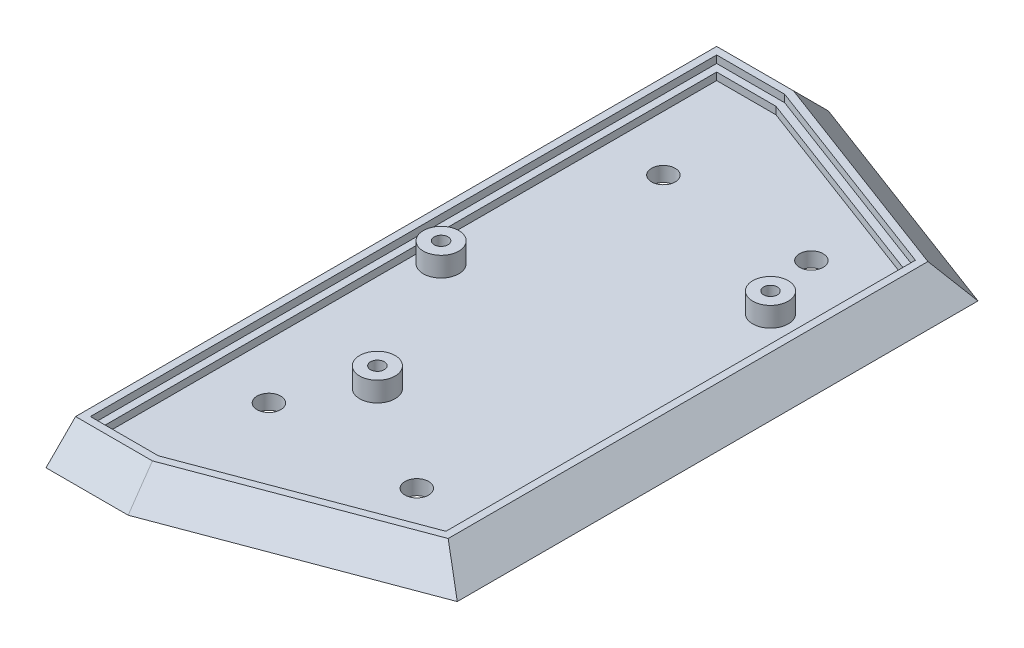
from build123d import *

# Parameters (mm, degrees)
CUT_EXTRUDE4_DEPTH  = 1.905
SKETCH15_R          = 2.286
BOSS_EXTRUDE3_DEPTH = 2.54
SKETCH17_R          = 0.889
CUT_EXTRUDE5_DEPTH  = 3.81
CUT_EXTRUDE6_DEPTH  = 0.9525
CUT_EXTRUDE9_DEPTH  = 205.915011065


with BuildPart() as part:
    # Sketch2 → Loft3 section 0
    with BuildSketch(Plane(origin=(0, 0, 0), x_dir=(1, 0, 0), z_dir=(0, 1, 0))):
        with BuildLine():
            Line((153.170003889, 0), (183.992068321, 11.558274162))
            Line((183.992068321, 11.558274162), (183.992068321, 78.611725838))
            Line((183.992068321, 78.611725838), (153.170003889, 90.17))
            Line((153.170003889, 90.17), (142.590068321, 90.17))
            Line((142.590068321, 90.17), (142.590068321, 0))
            Line((142.590068321, 0), (153.170003889, 0))
        make_face()
    # Sketch3 → Loft3 section 1
    with BuildSketch(Plane(origin=(0, 3.81, 0), x_dir=(1, 0, 0), z_dir=(0, 1, 0))):
        with BuildLine():
            Line((142.590068321, 3.81), (142.590068321, 86.36))
            Line((142.590068321, 86.36), (152.479119132, 86.36))
            Line((152.479119132, 86.36), (180.182068321, 75.971394054))
            Line((180.182068321, 75.971394054), (180.182068321, 14.198605946))
            Line((180.182068321, 14.198605946), (152.479119132, 3.81))
            Line((152.479119132, 3.81), (142.590068321, 3.81))
        make_face()
    loft()

    # Sketch14 → Cut-Extrude4 (cut)
    with BuildSketch(Plane(origin=(0, 3.81, 0), x_dir=(1, 0, 0), z_dir=(0, 1, 0))):
        Polygon((178.277068321, 74.651228162), (152.133676754, 84.455), (144.495068321, 84.455), (144.495068321, 5.715), (152.133676754, 5.715), (178.277068321, 15.518771838), align=None)
    extrude(amount=-CUT_EXTRUDE4_DEPTH, mode=Mode.SUBTRACT)

    # Sketch15 → Boss-Extrude3 (add)
    with BuildSketch(Plane(origin=(0, 1.905, 0), x_dir=(1, 0, 0), z_dir=(0, 1, 0))):
        with Locations(Location((173.959068321, 61.9252, 0), (0, 0, 270))):
            Circle(SKETCH15_R)
        with Locations(Location((147.162068321, 46.3042, 0), (0, 0, 270))):
            Circle(SKETCH15_R)
        with Locations(Location((156.991868321, 28.2702, 0), (0, 0, 270))):
            Circle(SKETCH15_R)
    extrude(amount=BOSS_EXTRUDE3_DEPTH)

    # Sketch17 → Cut-Extrude5 (cut)
    with BuildSketch(Plane(origin=(0, 4.445, 0), x_dir=(1, 0, 0), z_dir=(0, 1, 0))):
        with Locations(Location((156.991868321, 28.2702, 0), (0, 0, 270))):
            Circle(SKETCH17_R)
        with Locations(Location((147.162068321, 46.3042, 0), (0, 0, 270))):
            Circle(SKETCH17_R)
        with Locations(Location((173.959068321, 61.9252, 0), (0, 0, 270))):
            Circle(SKETCH17_R)
    extrude(amount=-CUT_EXTRUDE5_DEPTH, mode=Mode.SUBTRACT)

    # Sketch18 → Cut-Extrude6 (cut)
    with BuildSketch(Plane(origin=(0, 3.81, 0), x_dir=(1, 0, 0), z_dir=(0, 1, 0))):
        Polygon((179.229568321, 14.858688892), (179.229568321, 75.311311108), (152.306397943, 85.4075), (143.542568321, 85.4075), (143.542568321, 4.7625), (152.306397943, 4.7625), align=None)
        Polygon((178.277068321, 15.518771838), (178.277068321, 74.651228162), (152.133676754, 84.455), (144.495068321, 84.455), (144.495068321, 5.715), (152.133676754, 5.715), align=None, mode=Mode.SUBTRACT)
    extrude(amount=-CUT_EXTRUDE6_DEPTH, mode=Mode.SUBTRACT)

    # Sketch22 → Cut-Extrude9 (cut, through all)
    with BuildSketch(Plane(origin=(0, 1.905, 0), x_dir=(1, 0, 0), z_dir=(0, 1, 0))):
        with BuildLine():
            ThreePointArc((170.657068321, 21.209), (169.579437586, 20.762630735), (169.133068321, 19.685))
            Line((169.133068321, 19.685), (170.657068321, 19.685))
            Line((170.657068321, 19.685), (170.657068321, 21.209))
        make_face()
        with BuildLine():
            Line((170.657068321, 19.685), (169.133068321, 19.685))
            ThreePointArc((169.133068321, 19.685), (170.657068321, 18.161), (172.181068321, 19.685))
            ThreePointArc((172.181068321, 19.685), (171.734699055, 20.762630735), (170.657068321, 21.209))
            Line((170.657068321, 21.209), (170.657068321, 19.685))
        make_face()
        with BuildLine():
            ThreePointArc((151.607068321, 21.209), (150.529437586, 18.607369265), (153.131068321, 19.685))
            Line((153.131068321, 19.685), (151.607068321, 19.685))
            Line((151.607068321, 19.685), (151.607068321, 21.209))
        make_face()
        with BuildLine():
            Line((151.607068321, 19.685), (153.131068321, 19.685))
            ThreePointArc((153.131068321, 19.685), (152.684699055, 20.762630735), (151.607068321, 21.209))
            Line((151.607068321, 21.209), (151.607068321, 19.685))
        make_face()
        with BuildLine():
            ThreePointArc((169.133068321, 70.485), (169.579437586, 69.407369265), (170.657068321, 68.961))
            Line((170.657068321, 68.961), (170.657068321, 70.485))
            Line((170.657068321, 70.485), (169.133068321, 70.485))
        make_face()
        with BuildLine():
            Line((170.657068321, 70.485), (170.657068321, 68.961))
            ThreePointArc((170.657068321, 68.961), (171.734699055, 69.407369265), (172.181068321, 70.485))
            ThreePointArc((172.181068321, 70.485), (170.657068321, 72.009), (169.133068321, 70.485))
            Line((169.133068321, 70.485), (170.657068321, 70.485))
        make_face()
        with BuildLine():
            ThreePointArc((153.131068321, 70.485), (150.529437586, 71.562630735), (151.607068321, 68.961))
            Line((151.607068321, 68.961), (151.607068321, 70.485))
            Line((151.607068321, 70.485), (153.131068321, 70.485))
        make_face()
        with BuildLine():
            Line((151.607068321, 70.485), (151.607068321, 68.961))
            ThreePointArc((151.607068321, 68.961), (152.684699055, 69.407369265), (153.131068321, 70.485))
            Line((153.131068321, 70.485), (151.607068321, 70.485))
        make_face()
    extrude(amount=-CUT_EXTRUDE9_DEPTH, mode=Mode.SUBTRACT)


solid = part.part
